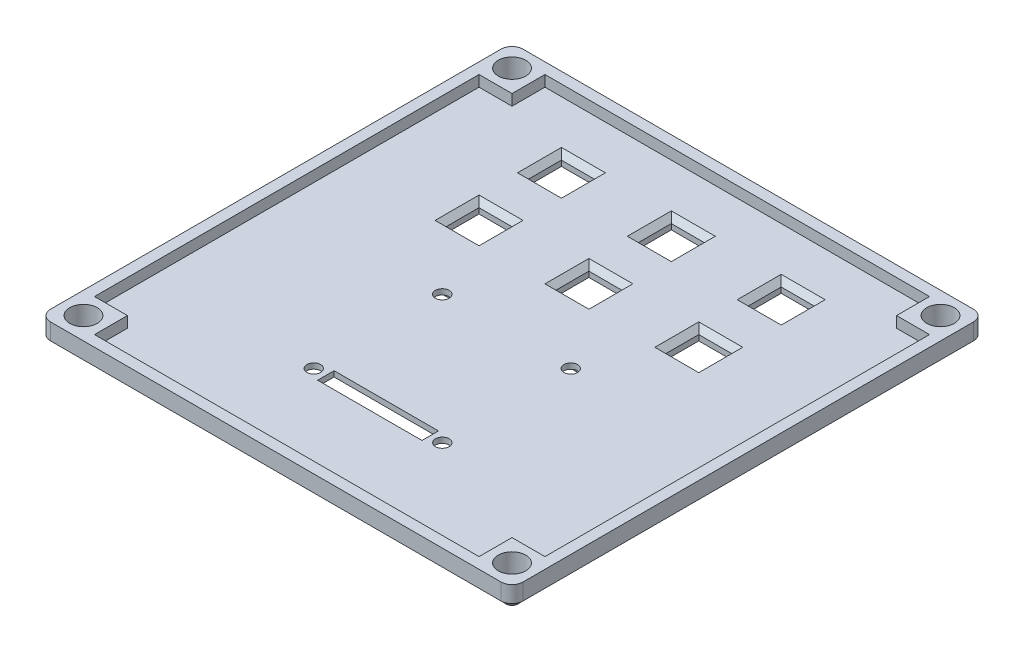
from build123d import *

# Parameters (mm, degrees)
SKETCH_2_W           = 86
SKETCH_2_H           = 86
EXTRUDE_1_DEPTH      = 2
SKETCH_3_W           = 86
SKETCH_3_H           = 86
SKETCH_3_W_2         = 82
SKETCH_3_H_2         = 82
EXTRUDE_2_DEPTH      = 2
SKETCH_4_W           = 6
SKETCH_4_H           = 2
EXTRUDE_3_DEPTH      = 6
SKETCH_5_W           = 6
SKETCH_5_H           = 2
EXTRUDE_4_DEPTH      = 6
SKETCH_6_R           = 2.5
CUT_EXTRUDE_1_DEPTH  = 61.942595941
FILLET_1_R           = 2
CHAMFER_1_SIZE       = 1
SKETCH_7_W           = 28
SKETCH_7_H           = 28
CUT_EXTRUDE_2_DEPTH  = 1
SKETCH_8_R           = 1.25
SKETCH_8_W           = 19
SKETCH_8_H           = 3
CUT_EXTRUDE_10_DEPTH = 61.88513776
SKETCH_9_W           = 6
SKETCH_9_H           = 6
CUT_EXTRUDE_11_DEPTH = 61.942595941
CHAMFER_2_SIZE       = 1
CHAMFER_3_SIZE       = 1


with BuildPart() as part:
    # 草图2 → 凸台-拉伸1 (new body)
    with BuildSketch(Plane(origin=(0, 0, 0), x_dir=(1, 0, 0), z_dir=(0, 1, 0))):
        Rectangle(SKETCH_2_W, SKETCH_2_H)
    extrude(amount=EXTRUDE_1_DEPTH)

    # 草图3 → 凸台-拉伸2 (add)
    with BuildSketch(Plane(origin=(0, 2, 0), x_dir=(1, 0, 0), z_dir=(0, 1, 0))):
        Rectangle(SKETCH_3_W, SKETCH_3_H)
        Rectangle(SKETCH_3_W_2, SKETCH_3_H_2, mode=Mode.SUBTRACT)
    extrude(amount=EXTRUDE_2_DEPTH)

    # 草图4 → 凸台-拉伸3 (add)
    with BuildSketch(Plane(origin=(0, 0, 41), x_dir=(-1, 0, 0), z_dir=(0, 0, -1))):
        with Locations((-38, 3)):
            Rectangle(SKETCH_4_W, SKETCH_4_H)
        with Locations((38, 3)):
            Rectangle(SKETCH_4_W, SKETCH_4_H)
    extrude(amount=EXTRUDE_3_DEPTH)

    # 草图5 → 凸台-拉伸4 (add)
    with BuildSketch(Plane.XY.offset(-41)):
        with Locations((-38, 3)):
            Rectangle(SKETCH_5_W, SKETCH_5_H)
        with Locations((38, 3)):
            Rectangle(SKETCH_5_W, SKETCH_5_H)
    extrude(amount=EXTRUDE_4_DEPTH)

    # 草图6 → 切除-拉伸1 (cut, through all)
    with BuildSketch(Plane(origin=(0, 4, 0), x_dir=(1, 0, 0), z_dir=(0, 1, 0))):
        with Locations(Location((-39, 39, 0), (0, 0, 270))):
            Circle(SKETCH_6_R)
        with Locations(Location((39, 39, 0), (0, 0, 90))):
            Circle(SKETCH_6_R)
        with Locations(Location((39, -39, 0), (0, 0, 270))):
            Circle(SKETCH_6_R)
        with Locations(Location((-39, -39, 0), (0, 0, 90))):
            Circle(SKETCH_6_R)
    extrude(amount=-CUT_EXTRUDE_1_DEPTH, mode=Mode.SUBTRACT)

    # 圆角1
    fillet_1_edges = [part.edges().sort_by_distance(p)[0] for p in [
        (43, 2, 43),
        (-43, 2, 43),
        (-43, 2, -43),
        (43, 2, -43),
    ]]
    fillet(fillet_1_edges, radius=FILLET_1_R)

    # 倒角1
    chamfer_1_edges = [part.edges().sort_by_distance(p)[0] for p in [
        (-43, 0, 0),
        (43, 0, 0),
        (0, 0, 43),
        (0, 0, -43),
        (42.414213562, 0, -42.414213562),
        (42.414213562, 0, 42.414213562),
        (-42.414213562, 0, 42.414213562),
        (-42.414213562, 0, -42.414213562),
    ]]
    chamfer(chamfer_1_edges, length=CHAMFER_1_SIZE)

    # 草图7 → 切除-拉伸2 (cut)
    with BuildSketch(Plane.XZ):
        with Locations((0, 13)):
            Rectangle(SKETCH_7_W, SKETCH_7_H)
    extrude(amount=-CUT_EXTRUDE_2_DEPTH, mode=Mode.SUBTRACT)

    # 草图8 → 切除-拉伸10 (cut, through all)
    with BuildSketch(Plane.XZ.offset(-1)):
        with Locations(Location((-11.7, 24.382645166, 0), (0, 0, 270))):
            Circle(SKETCH_8_R)
        with Locations(Location((11.7, 24.382645166, 0), (0, 0, 270))):
            Circle(SKETCH_8_R)
        with Locations(Location((-11.7, 1, 0), (0, 0, 270))):
            Circle(SKETCH_8_R)
        with Locations(Location((11.7, 1, 0), (0, 0, 270))):
            Circle(SKETCH_8_R)
        with Locations((0, 24.382645166)):
            Rectangle(SKETCH_8_W, SKETCH_8_H)
    extrude(amount=-CUT_EXTRUDE_10_DEPTH, mode=Mode.SUBTRACT)

    # 草图9 → 切除-拉伸11 (cut, through all)
    with BuildSketch(Plane.XZ):
        with Locations((0, -14)):
            Rectangle(SKETCH_9_W, SKETCH_9_H)
        with Locations((-20, -14)):
            Rectangle(SKETCH_9_W, SKETCH_9_H)
        with Locations((20, -14)):
            Rectangle(SKETCH_9_W, SKETCH_9_H)
        with Locations((-20, -29)):
            Rectangle(SKETCH_9_W, SKETCH_9_H)
        with Locations((0, -29)):
            Rectangle(SKETCH_9_W, SKETCH_9_H)
        with Locations((20, -29)):
            Rectangle(SKETCH_9_W, SKETCH_9_H)
    extrude(amount=-CUT_EXTRUDE_11_DEPTH, mode=Mode.SUBTRACT)

    # 倒角2
    chamfer_2_edges = [part.edges().sort_by_distance(p)[0] for p in [
        (-3, 2, -29),
        (0, 2, -26),
        (3, 2, -29),
        (0, 2, -32),
        (20, 2, -26),
        (23, 2, -29),
        (20, 2, -32),
        (17, 2, -29),
        (-20, 2, -26),
        (-17, 2, -29),
        (-20, 2, -32),
        (-23, 2, -29),
    ]]
    chamfer(chamfer_2_edges, length=CHAMFER_2_SIZE)

    # 倒角3
    chamfer_3_edges = [part.edges().sort_by_distance(p)[0] for p in [
        (17, 2, -14),
        (20, 2, -11),
        (23, 2, -14),
        (20, 2, -17),
        (-23, 2, -14),
        (-20, 2, -11),
        (-17, 2, -14),
        (-20, 2, -17),
        (-3, 2, -14),
        (0, 2, -11),
        (3, 2, -14),
        (0, 2, -17),
    ]]
    chamfer(chamfer_3_edges, length=CHAMFER_3_SIZE)


solid = part.part
